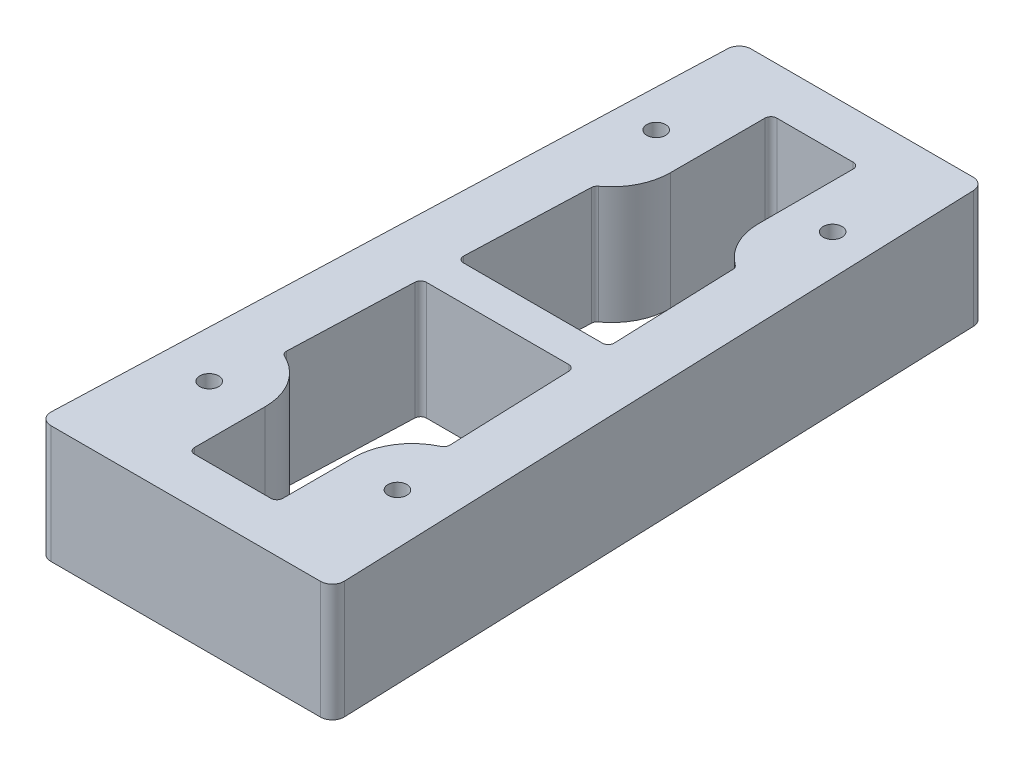
from build123d import *

# Parameters (mm, degrees)
SKETCH_1_R          = 1.6
SKETCH_1_R_2        = 2.1
EXTRUDE_1_DEPTH     = 20
EXTRUDE_2_DEPTH     = 20
SKETCH_3_R          = 1.6
CUT_EXTRUDE_1_DEPTH = 169.07736314
SKETCH_4_R          = 1.6
CUT_EXTRUDE_2_DEPTH = 169.07736314
SKETCH_6_W          = 50
SKETCH_6_H          = 15
SKETCH_6_W_2        = 77.817383139
SKETCH_6_H_2        = 81.542414759
CUT_EXTRUDE_3_DEPTH = 169.07736314
FILLET_1_R          = 2
CUT_EXTRUDE_4_DEPTH = 120.357877938
FILLET_2_R          = 1
SKETCH_8_W          = 15
SKETCH_8_H          = 22
SKETCH_8_H_2        = 25
CUT_EXTRUDE_5_DEPTH = 120.357877938
FILLET_3_R          = 10
FILLET_4_R          = 1
SKETCH_9_W          = 25.911411074
SKETCH_9_H          = 3
EXTRUDE_3_DEPTH     = 20
FILLET_5_R          = 1


with BuildPart() as part:
    # 草图1 → 凸台-拉伸1 (new body)
    with BuildSketch(Plane(origin=(0, 0, 0), x_dir=(1, 0, 0), z_dir=(0, 1, 0))):
        Polygon((-25, 0), (-19, 0), (-19, 165), (19, 165), (19, 0), (25, 0), (25, -15), (-25, -15), align=None)
        with Locations(Location((0, -7.5, 0), (0, 0, 270))):
            Circle(SKETCH_1_R, mode=Mode.SUBTRACT)
        with Locations(Location((20, -7.5, 0), (0, 0, 270))):
            Circle(SKETCH_1_R, mode=Mode.SUBTRACT)
        with Locations(Location((-20, -7.5, 0), (0, 0, 270))):
            Circle(SKETCH_1_R, mode=Mode.SUBTRACT)
        with Locations(Location((-15, 156, 0), (0, 0, 270))):
            Circle(SKETCH_1_R_2, mode=Mode.SUBTRACT)
        with Locations(Location((15, 156, 0), (0, 0, 270))):
            Circle(SKETCH_1_R_2, mode=Mode.SUBTRACT)
    extrude(amount=EXTRUDE_1_DEPTH)

    # 草图2 → 凸台-拉伸2 (add)
    with BuildSketch(Plane(origin=(0, 20, 0), x_dir=(1, 0, 0), z_dir=(0, 1, 0))):
        Polygon((-19, 165), (-25, 0), (-19, 0), align=None)
        Polygon((19, 165), (25, 0), (19, 0), align=None)
    extrude(amount=-EXTRUDE_2_DEPTH)

    # 草图3 → 切除-拉伸1 (cut, through all)
    with BuildSketch(Plane(origin=(0, 20, 0), x_dir=(1, 0, 0), z_dir=(0, 1, 0))):
        with Locations(Location((16, 20, 0), (0, 0, 270))):
            Circle(SKETCH_3_R)
        with Locations(Location((-16, 20, 0), (0, 0, 270))):
            Circle(SKETCH_3_R)
    extrude(amount=-CUT_EXTRUDE_1_DEPTH, mode=Mode.SUBTRACT)

    # 草图4 → 切除-拉伸2 (cut, through all)
    with BuildSketch(Plane(origin=(0, 20, 0), x_dir=(1, 0, 0), z_dir=(0, 1, 0))):
        with Locations(Location((-15, 95, 0), (0, 0, 270))):
            Circle(SKETCH_4_R)
        with Locations(Location((15, 95, 0), (0, 0, 270))):
            Circle(SKETCH_4_R)
    extrude(amount=-CUT_EXTRUDE_2_DEPTH, mode=Mode.SUBTRACT)

    # 草图6 → 切除-拉伸3 (cut, through all)
    with BuildSketch(Plane(origin=(0, 20, 0), x_dir=(1, 0, 0), z_dir=(0, 1, 0))):
        with Locations((0, -7.5)):
            Rectangle(SKETCH_6_W, SKETCH_6_H)
        with Locations((-0.977931814, 155.77120738)):
            Rectangle(SKETCH_6_W_2, SKETCH_6_H_2)
    extrude(amount=-CUT_EXTRUDE_3_DEPTH, mode=Mode.SUBTRACT)

    # 圆角1
    fillet_1_edges = [part.edges().sort_by_distance(p)[0] for p in [
        (20.818181818, 10, -115),
        (25, 10, 0),
        (-25, 10, 0),
        (-20.818181818, 10, -115),
    ]]
    fillet(fillet_1_edges, radius=FILLET_1_R)

    # 草图7 → 切除-拉伸4 (cut, through all)
    with BuildSketch(Plane.XZ):
        Polygon((-13.902481523, -30), (-12.011572432, -82), (12.011572432, -82), (13.902481523, -30), align=None)
    extrude(amount=-CUT_EXTRUDE_4_DEPTH, mode=Mode.SUBTRACT)

    # 圆角2
    fillet_2_edges = [part.edges().sort_by_distance(p)[0] for p in [
        (-12.011572432, 10, -82),
        (-13.902481523, 10, -30),
        (13.902481523, 10, -30),
        (12.011572432, 10, -82),
    ]]
    fillet(fillet_2_edges, radius=FILLET_2_R)

    # 草图8 → 切除-拉伸5 (cut, through all)
    with BuildSketch(Plane(origin=(0, 20, 0), x_dir=(1, 0, 0), z_dir=(0, 1, 0))):
        with Locations((0, 19)):
            Rectangle(SKETCH_8_W, SKETCH_8_H)
        with Locations((0, 94.5)):
            Rectangle(SKETCH_8_W, SKETCH_8_H_2)
    extrude(amount=-CUT_EXTRUDE_5_DEPTH, mode=Mode.SUBTRACT)

    # 圆角3
    fillet_3_edges = [part.edges().sort_by_distance(p)[0] for p in [
        (7.5, 10, -82),
        (-7.5, 10, -82),
        (7.5, 10, -30),
        (-7.5, 10, -30),
    ]]
    fillet(fillet_3_edges, radius=FILLET_3_R)

    # 圆角4
    fillet_4_edges = [part.edges().sort_by_distance(p)[0] for p in [
        (7.5, 10, -8),
        (-7.5, 10, -8),
        (7.5, 10, -107),
        (-7.5, 10, -107),
    ]]
    fillet(fillet_4_edges, radius=FILLET_4_R)

    # 草图9 → 凸台-拉伸3 (add)
    with BuildSketch(Plane(origin=(0, 20, 0), x_dir=(1, 0, 0), z_dir=(0, 1, 0))):
        with Locations((0, 54.536339618)):
            Rectangle(SKETCH_9_W, SKETCH_9_H)
        Polygon((13.064796446, 53.036339618), (12.955705537, 56.036339618), (12.955705537, 53.036339618), align=None)
        Polygon((-12.846614628, 59.036339618), (-12.955705537, 56.036339618), (12.955705537, 56.036339618), (12.846614628, 59.036339618), align=None)
        Polygon((-12.955705537, 53.036339618), (-12.955705537, 56.036339618), (-13.064796446, 53.036339618), align=None)
    extrude(amount=-EXTRUDE_3_DEPTH)

    # 圆角5
    fillet_5_edges = [part.edges().sort_by_distance(p)[0] for p in [
        (-12.846614628, 10, -59.036339618),
        (-13.064796446, 10, -53.036339618),
        (13.064796446, 10, -53.036339618),
        (12.846614628, 10, -59.036339618),
    ]]
    fillet(fillet_5_edges, radius=FILLET_5_R)


solid = part.part
